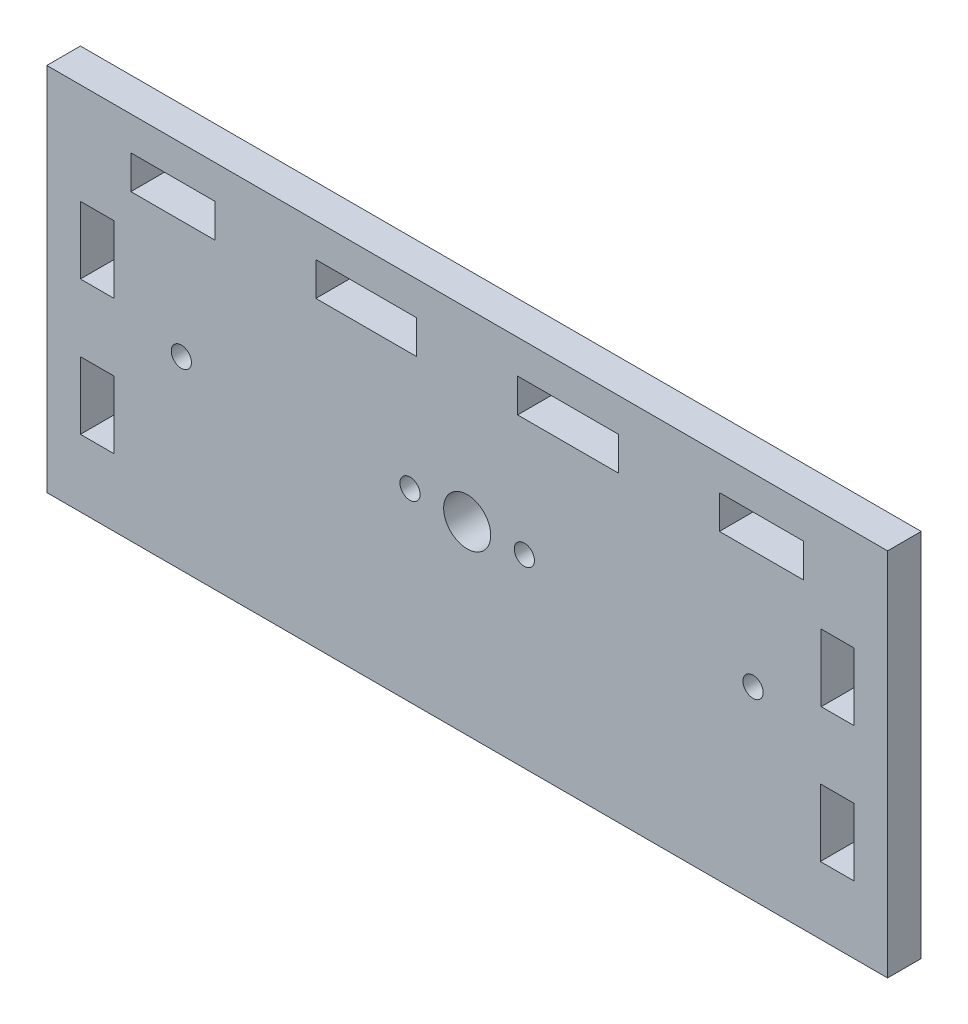
from build123d import *

# Parameters (mm, degrees)
ESQUISSE1_W             = 125
ESQUISSE1_H             = 55
BOSS_EXTRU_3_DEPTH      = 5
ESQUISSE2_R             = 3.5
ENL_V_MAT_EXTRU_1_DEPTH = 5
ESQUISSE3_W             = 4.868398839
ESQUISSE3_H             = 10
ESQUISSE3_W_2           = 5
ESQUISSE3_W_3           = 12.5
ESQUISSE3_H_2           = 5
ESQUISSE3_W_4           = 15
ENL_V_MAT_EXTRU_2_DEPTH = 5
ESQUISSE4_R             = 1.5
ENL_V_MAT_EXTRU_3_DEPTH = 2.5
ESQUISSE5_R             = 1.5
ENL_V_MAT_EXTRU_4_DEPTH = 77.546049734


with BuildPart() as part:
    # Esquisse1 → Boss.-Extru.3 (new body)
    with BuildSketch(Plane.XY):
        with Locations((-4.111168033, 9.879807692)):
            Rectangle(ESQUISSE1_W, ESQUISSE1_H)
    extrude(amount=BOSS_EXTRU_3_DEPTH)

    # Esquisse2 → Enlèv. mat.-Extru.1 (cut)
    with BuildSketch(Plane.XY.offset(5)):
        with Locations((-4.111168033, 9.879807692)):
            Circle(ESQUISSE2_R)
    extrude(amount=-ENL_V_MAT_EXTRU_1_DEPTH, mode=Mode.SUBTRACT)

    # Esquisse3 → Enlèv. mat.-Extru.2 (cut)
    with BuildSketch(Plane.XY.offset(5)):
        with Locations((50.954632547, 17.379807692)):
            Rectangle(ESQUISSE3_W, ESQUISSE3_H)
        with Locations((50.888831967, -2.620192308)):
            Rectangle(ESQUISSE3_W_2, ESQUISSE3_H)
        with Locations((-59.111168033, 17.379807692)):
            Rectangle(ESQUISSE3_W_2, ESQUISSE3_H)
        with Locations((-59.111168033, -2.620192308)):
            Rectangle(ESQUISSE3_W_2, ESQUISSE3_H)
        with Locations((-47.861168033, 29.879807692)):
            Rectangle(ESQUISSE3_W_3, ESQUISSE3_H_2)
        with Locations((-19.111168033, 29.879807692)):
            Rectangle(ESQUISSE3_W_4, ESQUISSE3_H_2)
        with Locations((10.888831967, 29.879807692)):
            Rectangle(ESQUISSE3_W_4, ESQUISSE3_H_2)
        with Locations((39.638831967, 29.879807692)):
            Rectangle(ESQUISSE3_W_3, ESQUISSE3_H_2)
    extrude(amount=-ENL_V_MAT_EXTRU_2_DEPTH, mode=Mode.SUBTRACT)

    # Esquisse4 → Enlèv. mat.-Extru.3 (cut)
    with BuildSketch(Plane.XY.offset(5)):
        with Locations((-46.611168033, 9.879807692)):
            Circle(ESQUISSE4_R)
        with Locations((38.388831967, 9.879807692)):
            Circle(ESQUISSE4_R)
    extrude(amount=-ENL_V_MAT_EXTRU_3_DEPTH, mode=Mode.SUBTRACT)

    # Esquisse5 → Enlèv. mat.-Extru.4 (cut, through all)
    with BuildSketch(Plane.XY.offset(5)):
        with Locations((4.388831967, 9.879807692)):
            Circle(ESQUISSE5_R)
        with Locations((-12.611168033, 9.879807692)):
            Circle(ESQUISSE5_R)
    extrude(amount=-ENL_V_MAT_EXTRU_4_DEPTH, mode=Mode.SUBTRACT)


solid = part.part
